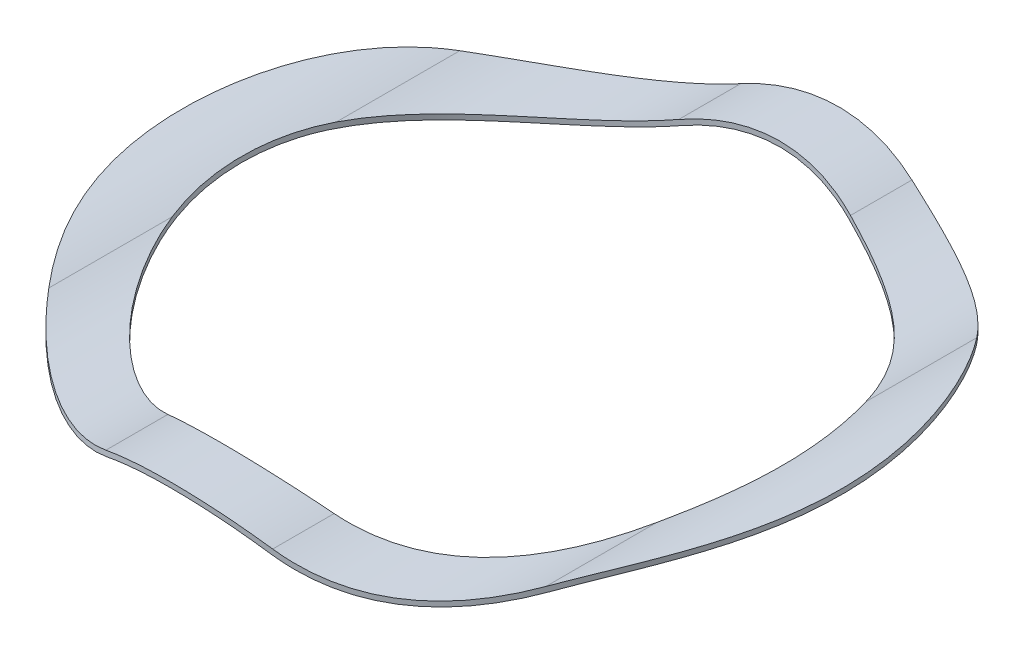
from build123d import *

# Parameters (mm, degrees)
EXTRU_MINCE1_DEPTH      = 40
ESQUISSE2_OUTSIDE_W     = 64.814
ESQUISSE2_OUTSIDE_H     = 54.814
ESQUISSE2_OUTSIDE_R     = 19.5
ESQUISSE2_OUTSIDE_R_2   = 16
ENL_V_MAT_EXTRU_1_DEPTH = 40


with BuildPart() as part:
    # Esquisse1 → Extru.-Mince1 (new body)
    with BuildSketch(Plane.XY):
        with BuildLine():
            ThreePointArc((0, 0), (5, 1), (10, 0))
            ThreePointArc((10, 0), (15, -1), (20, 0))
            ThreePointArc((20, 0), (25, 1), (30, 0))
            ThreePointArc((30, 0), (35, -1), (40, 0))
            ThreePointArc((40, 0), (45, 1), (50, 0))
            Line((50, 0), (49.884615385, -0.276923077))
            ThreePointArc((49.884615385, -0.276923077), (45, 0.7), (40.115384615, -0.276923077))
            ThreePointArc((40.115384615, -0.276923077), (35, -1.3), (29.884615385, -0.276923077))
            ThreePointArc((29.884615385, -0.276923077), (25, 0.7), (20.115384615, -0.276923077))
            ThreePointArc((20.115384615, -0.276923077), (15, -1.3), (9.884615385, -0.276923077))
            ThreePointArc((9.884615385, -0.276923077), (5, 0.7), (0.115384615, -0.276923077))
            Line((0.115384615, -0.276923077), (0, 0))
        make_face()
    extrude(amount=-EXTRU_MINCE1_DEPTH)

    # Esquisse2 outside → Enlèv. mat.-Extru.1 (cut)
    # profile 1 of 2: a face of its own
    with BuildSketch(Plane(origin=(0, 5, 0), x_dir=(-1, 0, 0), z_dir=(0, 1, 0))):
        with Locations((-25, -20)):
            Rectangle(ESQUISSE2_OUTSIDE_W, ESQUISSE2_OUTSIDE_H)
        with Locations(Location((-25.24411071, -19.869880187, 0), (0, 0, 103.767029359))):
            Circle(ESQUISSE2_OUTSIDE_R, mode=Mode.SUBTRACT)
    # profile 2 of 2: a face of its own
    with BuildSketch(Plane(origin=(0, 5, 0), x_dir=(-1, 0, 0), z_dir=(0, 1, 0))):
        with Locations(Location((-25.24411071, -19.869880187, 0), (0, 0, 106.859844414))):
            Circle(ESQUISSE2_OUTSIDE_R_2)
    extrude(amount=-ENL_V_MAT_EXTRU_1_DEPTH, mode=Mode.SUBTRACT)


solid = part.part
